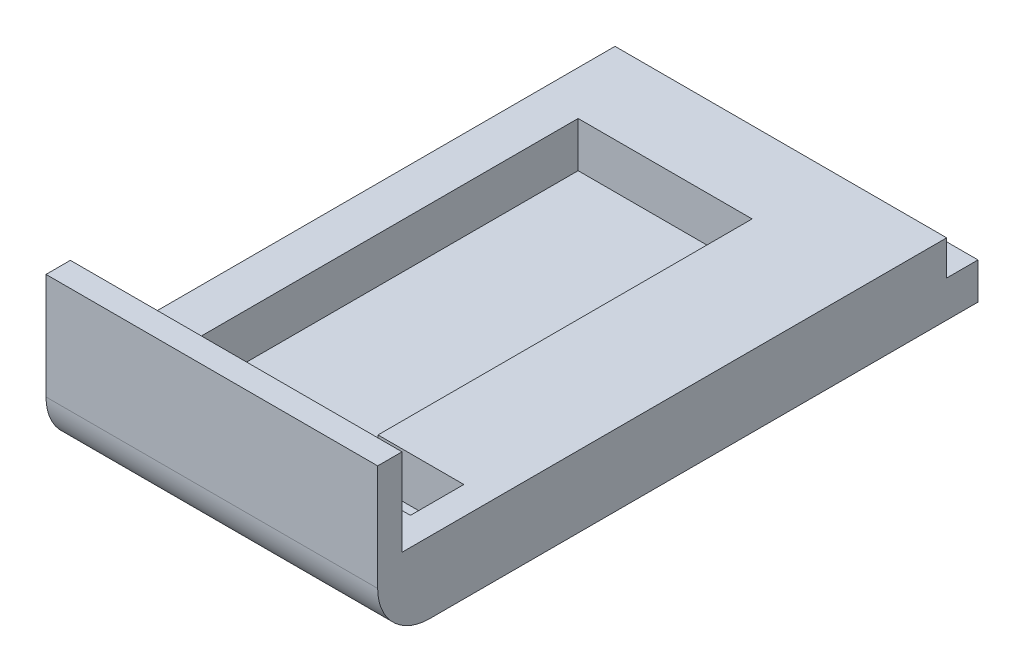
from build123d import *

# Parameters (mm, degrees)
EXTRUDE_1_DEPTH     = 19.06
CUT_EXTRUDE_1_DEPTH = 2.6
SKETCH_3_W          = 19.06
SKETCH_3_H          = 1.9
EXTRUDE_2_DEPTH     = 5
CUT_EXTRUDE_2_REACH = 41.731
SKETCH_4_W          = 1.8
SKETCH_4_H          = 2
SKETCH_5_W          = 0.5
SKETCH_5_H          = 5
CUT_EXTRUDE_3_DEPTH = 40.730763899


with BuildPart() as part:
    # 草图1 → 凸台-拉伸1 (new body)
    with BuildSketch(Plane(origin=(0, 0, 0), x_dir=(0, 0, -1), z_dir=(1, 0, 0))):
        with BuildLine():
            Line((0, 0), (0, -1.1))
            ThreePointArc((0, -1.1), (0.878679656, -3.221320344), (3, -4.1))
            Line((3, -4.1), (34.5, -4.1))
            Line((34.5, -4.1), (34.5, 0))
            Line((34.5, 0), (0, 0))
        make_face()
    extrude(amount=EXTRUDE_1_DEPTH)

    # 草图2 → 切除-拉伸1 (cut)
    with BuildSketch(Plane(origin=(0, 0, 0), x_dir=(1, 0, 0), z_dir=(0, 1, 0))):
        Polygon((2.53, 28.05), (12.53, 28.05), (12.53, 6.55), (17.464199463, 6.55), (17.464199463, 4.05), (17.464199463, 3.479016937), (12.53, 3.479016937), (11.977918136, 3.479016937), (11.977918136, 4.05), (2.53, 4.05), align=None)
    extrude(amount=-CUT_EXTRUDE_1_DEPTH, mode=Mode.SUBTRACT)

    # 草图3 → 凸台-拉伸2 (add)
    with BuildSketch(Plane(origin=(0, 0, 0), x_dir=(1, 0, 0), z_dir=(0, 1, 0))):
        with Locations((9.53, 0.95)):
            Rectangle(SKETCH_3_W, SKETCH_3_H)
    extrude(amount=EXTRUDE_2_DEPTH)

    # 草图4 → 切除-拉伸2 (cut, up to next)
    with BuildSketch(Plane.ZY, mode=Mode.PRIVATE) as cut_extrude_2_sk1:
        with Locations((-33.6, -1)):
            Rectangle(SKETCH_4_W, SKETCH_4_H)
    cut_extrude_2_tool1 = extrude(cut_extrude_2_sk1.sketch, amount=-CUT_EXTRUDE_2_REACH, mode=Mode.PRIVATE) & part.part
    add(cut_extrude_2_tool1.solids().sort_by_distance((0, -1, -33.6))[0], mode=Mode.SUBTRACT)

    # 草图5 → 切除-拉伸3 (cut, through all)
    with BuildSketch(Plane(origin=(19.06, 0, 0), x_dir=(0, 0, -1), z_dir=(1, 0, 0))):
        with Locations((1.65, 2.5)):
            Rectangle(SKETCH_5_W, SKETCH_5_H)
    extrude(amount=-CUT_EXTRUDE_3_DEPTH, mode=Mode.SUBTRACT)


solid = part.part
